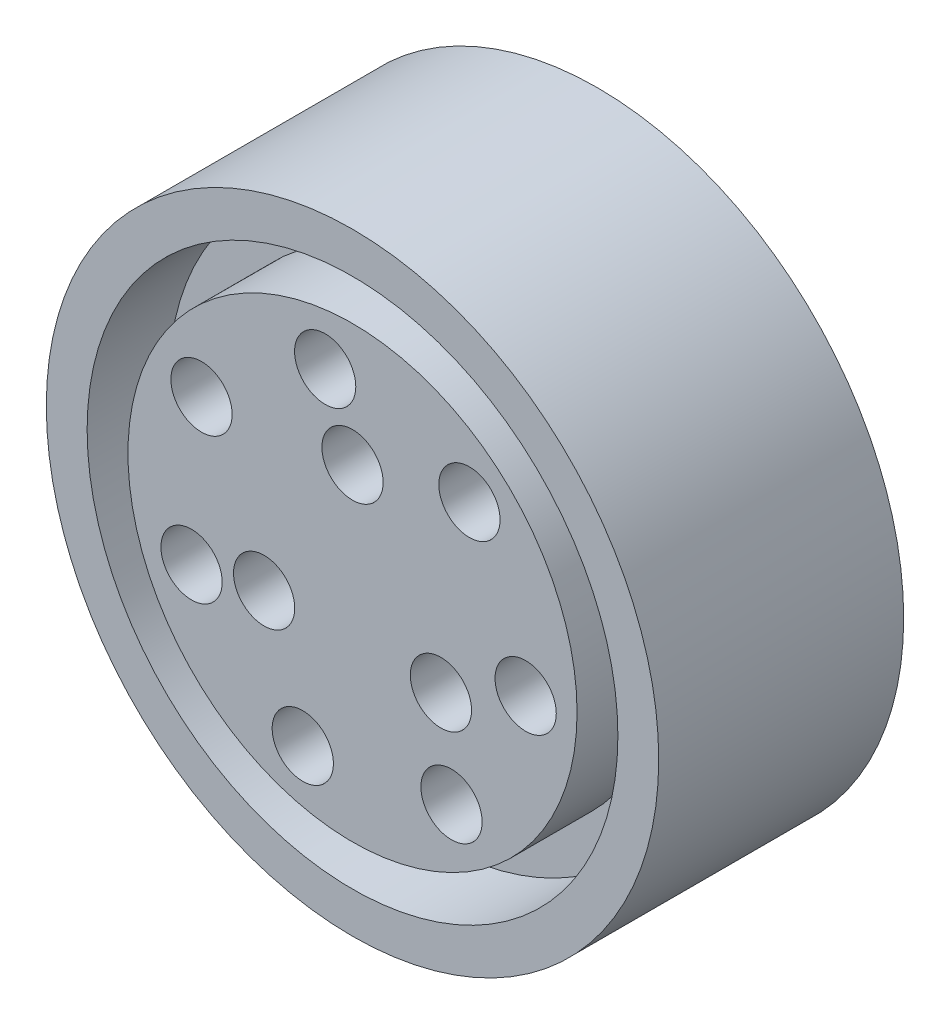
from build123d import *

# Parameters (mm, degrees)
SKETCH2_R           = 7.5
BOSS_EXTRUDE1_DEPTH = 6
SKETCH3_R           = 6.5
SKETCH3_R_2         = 5.5
CUT_EXTRUDE1_DEPTH  = 2
SKETCH4_R           = 0.75
CUT_EXTRUDE2_DEPTH  = 2


with BuildPart() as part:
    # Sketch2 → Boss-Extrude1 (new body)
    with BuildSketch(Plane.XY):
        with Locations((-17.844062558, -1.916140946)):
            Circle(SKETCH2_R)
    extrude(amount=BOSS_EXTRUDE1_DEPTH)

    # Sketch3 → Cut-Extrude1 (cut)
    with BuildSketch(Plane.XY.offset(6)):
        with Locations((-17.844062558, -1.916140946)):
            Circle(SKETCH3_R)
        with Locations((-17.844062558, -1.916140946)):
            Circle(SKETCH3_R_2, mode=Mode.SUBTRACT)
    extrude(amount=-CUT_EXTRUDE1_DEPTH, mode=Mode.SUBTRACT)

    # Sketch4 → Cut-Extrude2 (cut)
    with BuildSketch(Plane.XY.offset(6)):
        with Locations((-17.844062558, 0.583859054)):
            Circle(SKETCH4_R)
        with Locations((-15.678999049, -3.166140946)):
            Circle(SKETCH4_R)
        with Locations((-20.009126068, -3.166140946)):
            Circle(SKETCH4_R)
        with Locations((-21.542818561, 0.177111078)):
            Circle(SKETCH4_R)
        with Locations((-18.513628873, 2.280784232)):
            Circle(SKETCH4_R)
        with Locations((-14.980242093, 1.224087126)):
            Circle(SKETCH4_R)
        with Locations((-13.603370535, -2.197265767)):
            Circle(SKETCH4_R)
        with Locations((-15.419826565, -5.406925936)):
            Circle(SKETCH4_R)
        with Locations((-19.061781743, -5.987953808)):
            Circle(SKETCH4_R)
        with Locations((-21.786769538, -3.502823545)):
            Circle(SKETCH4_R)
    extrude(amount=-CUT_EXTRUDE2_DEPTH, mode=Mode.SUBTRACT)


solid = part.part
